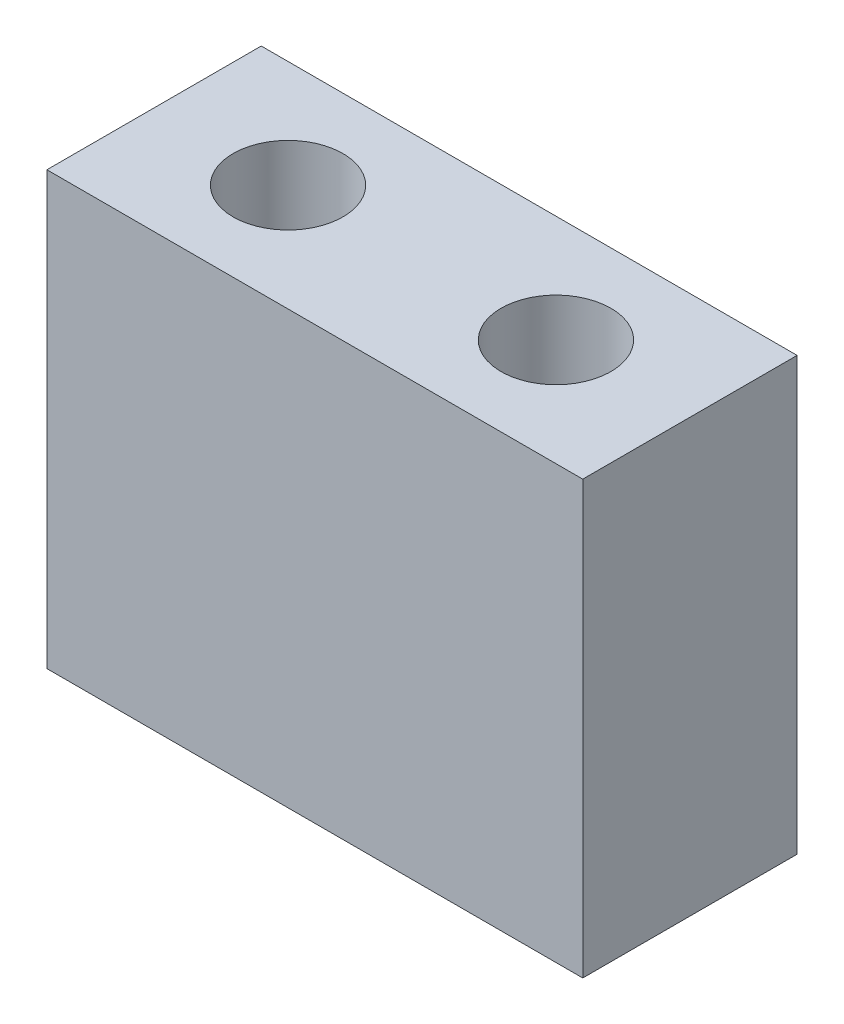
from build123d import *

# Parameters (mm, degrees)
SKETCH1_W           = 20
SKETCH1_H           = 8
BOSS_EXTRUDE1_DEPTH = 16.125
SKETCH2_R           = 2.05
CUT_EXTRUDE1_DEPTH  = 16.125


with BuildPart() as part:
    # Sketch1 → Boss-Extrude1 (new body)
    with BuildSketch(Plane(origin=(0, 0, 0), x_dir=(1, 0, 0), z_dir=(0, 1, 0))):
        Rectangle(SKETCH1_W, SKETCH1_H)
    extrude(amount=BOSS_EXTRUDE1_DEPTH)

    # Sketch2 → Cut-Extrude1 (cut)
    with BuildSketch(Plane(origin=(0, 16.125, 0), x_dir=(1, 0, 0), z_dir=(0, 1, 0))):
        with Locations(Location((-5, 0, 0), (0, 0, 270))):
            Circle(SKETCH2_R)
        with Locations(Location((5, 0, 0), (0, 0, 90))):
            Circle(SKETCH2_R)
    extrude(amount=-CUT_EXTRUDE1_DEPTH, mode=Mode.SUBTRACT)


solid = part.part
